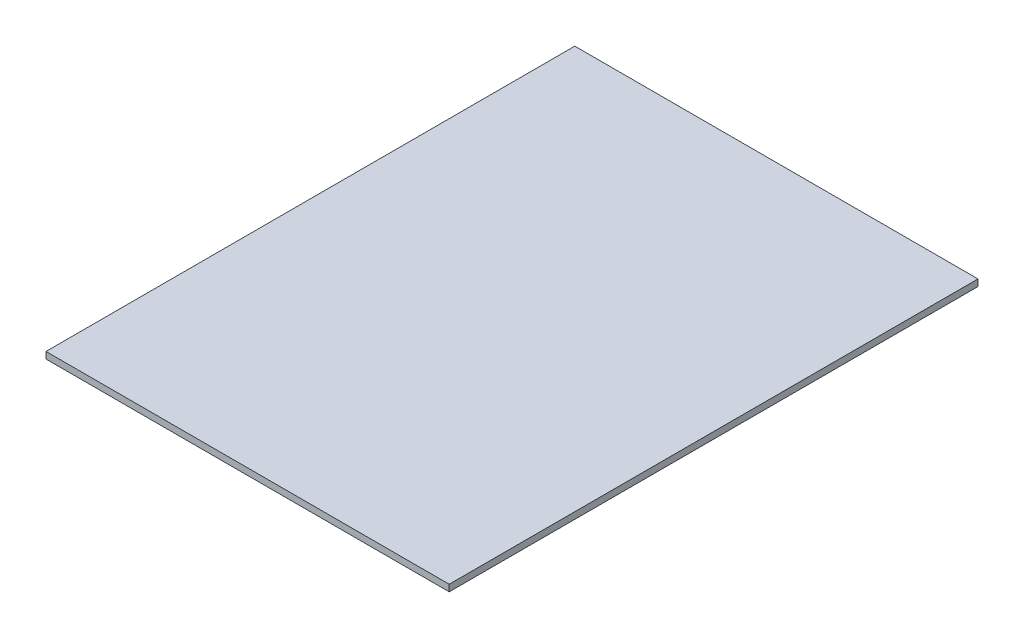
from build123d import *

# Parameters (mm, degrees)
SKETCH1_W           = 387.35
SKETCH1_H           = 508
BOSS_EXTRUDE1_DEPTH = 6.35


with BuildPart() as part:
    # Sketch1 → Boss-Extrude1 (new body)
    with BuildSketch(Plane(origin=(0, 0, 0), x_dir=(1, 0, 0), z_dir=(0, 1, 0))):
        Rectangle(SKETCH1_W, SKETCH1_H)
    extrude(amount=BOSS_EXTRUDE1_DEPTH)


solid = part.part
